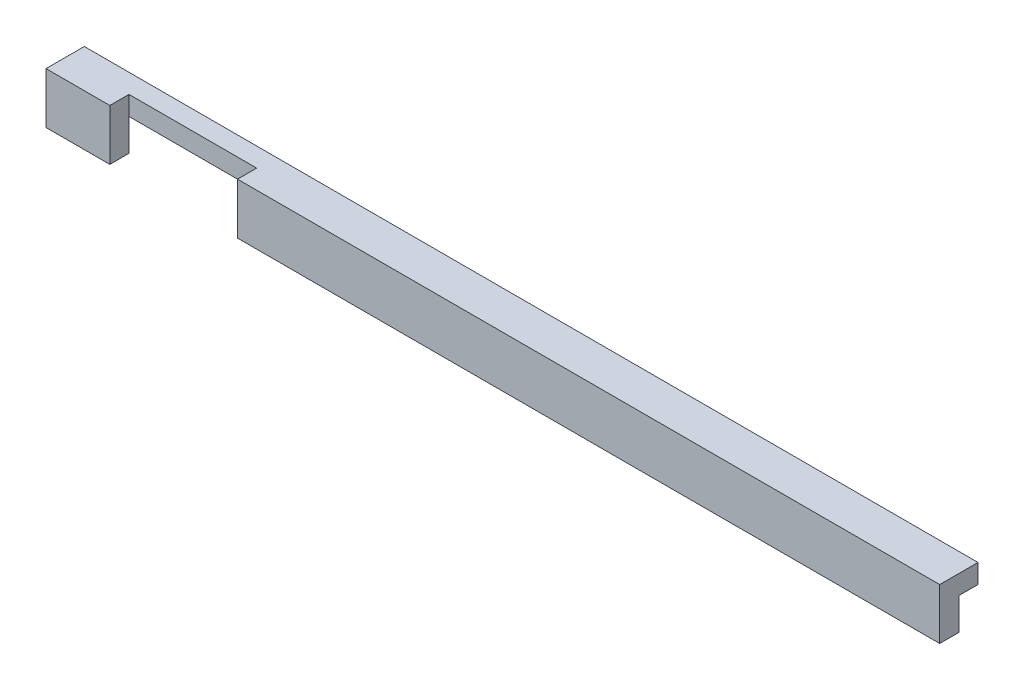
from build123d import *

# Parameters (mm, degrees)
SKETCH1_W           = 140
SKETCH1_H           = 8
BOSS_EXTRUDE1_DEPTH = 8
SKETCH2_W           = 3
SKETCH2_H           = 5
SKETCH2_W_2         = 2
SKETCH2_H_2         = 8
CUT_EXTRUDE1_DEPTH  = 140
SKETCH3_W           = 20
SKETCH3_H           = 8
CUT_EXTRUDE2_DEPTH  = 3


with BuildPart() as part:
    # Sketch1 → Boss-Extrude1 (new body)
    with BuildSketch(Plane(origin=(0, 0, 0), x_dir=(1, 0, 0), z_dir=(0, 1, 0))):
        Rectangle(SKETCH1_W, SKETCH1_H)
    extrude(amount=BOSS_EXTRUDE1_DEPTH)

    # Sketch2 → Cut-Extrude1 (cut)
    with BuildSketch(Plane(origin=(70, 0, 0), x_dir=(0, 0, -1), z_dir=(1, 0, 0))):
        with Locations((2.5, 2.5)):
            Rectangle(SKETCH2_W, SKETCH2_H)
        with Locations((-3, 4)):
            Rectangle(SKETCH2_W_2, SKETCH2_H_2)
    extrude(amount=-CUT_EXTRUDE1_DEPTH, mode=Mode.SUBTRACT)

    # Sketch3 → Cut-Extrude2 (cut)
    with BuildSketch(Plane.XY.offset(2)):
        with Locations((-50, 4)):
            Rectangle(SKETCH3_W, SKETCH3_H)
    extrude(amount=-CUT_EXTRUDE2_DEPTH, mode=Mode.SUBTRACT)


solid = part.part
